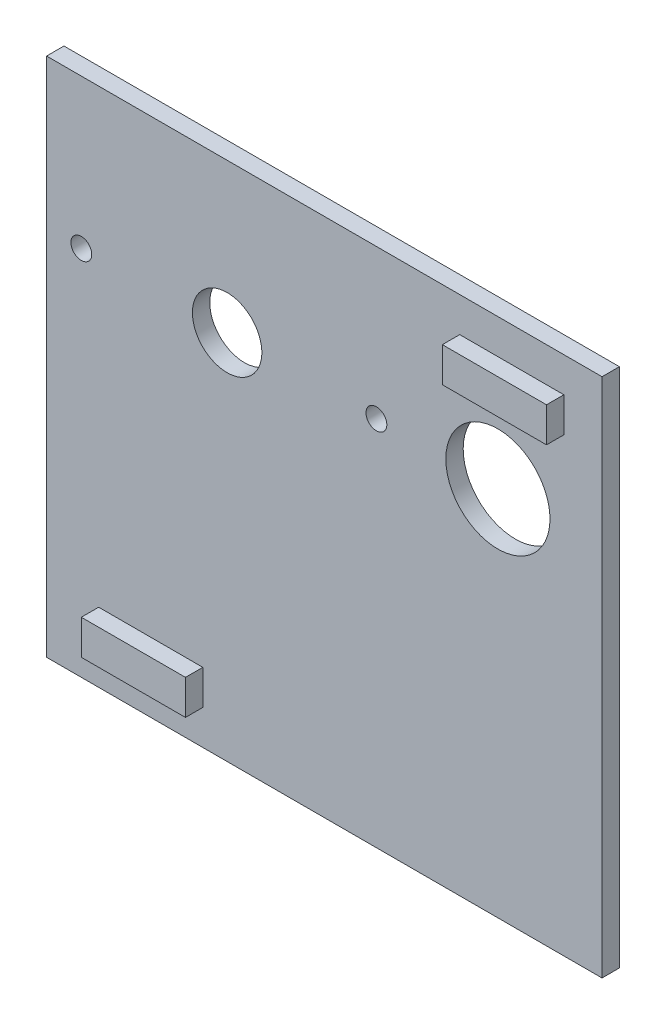
from build123d import *

# Parameters (mm, degrees)
SKETCH1_W           = 160
SKETCH1_H           = 150
BOSS_EXTRUDE1_DEPTH = 5
SKETCH2_W           = 30
SKETCH2_H           = 10
BOSS_EXTRUDE2_DEPTH = 5
SKETCH4_R           = 3
SKETCH4_R_2         = 10
SKETCH4_R_3         = 15
CUT_EXTRUDE1_DEPTH  = 15


with BuildPart() as part:
    # Sketch1 → Boss-Extrude1 (new body)
    with BuildSketch(Plane.XY):
        with Locations((-80, -75)):
            Rectangle(SKETCH1_W, SKETCH1_H)
    extrude(amount=BOSS_EXTRUDE1_DEPTH)

    # Sketch2 → Boss-Extrude2 (add)
    with BuildSketch(Plane.XY.offset(5)):
        with Locations((-26, -15)):
            Rectangle(SKETCH2_W, SKETCH2_H)
        with Locations((-130, -135)):
            Rectangle(SKETCH2_W, SKETCH2_H)
    extrude(amount=BOSS_EXTRUDE2_DEPTH)

    # Sketch4 → Cut-Extrude1 (cut)
    with BuildSketch(Plane.XY.offset(10)):
        with Locations(Location((-150, -43, 0), (0, 0, 180))):
            Circle(SKETCH4_R)
        with Locations(Location((-108, -43, 0), (0, 0, 180))):
            Circle(SKETCH4_R_2)
        with Locations(Location((-65, -43, 0), (0, 0, 180))):
            Circle(SKETCH4_R)
        with Locations(Location((-30, -43, 0), (0, 0, 180))):
            Circle(SKETCH4_R_3)
    extrude(amount=-CUT_EXTRUDE1_DEPTH, mode=Mode.SUBTRACT)


solid = part.part
